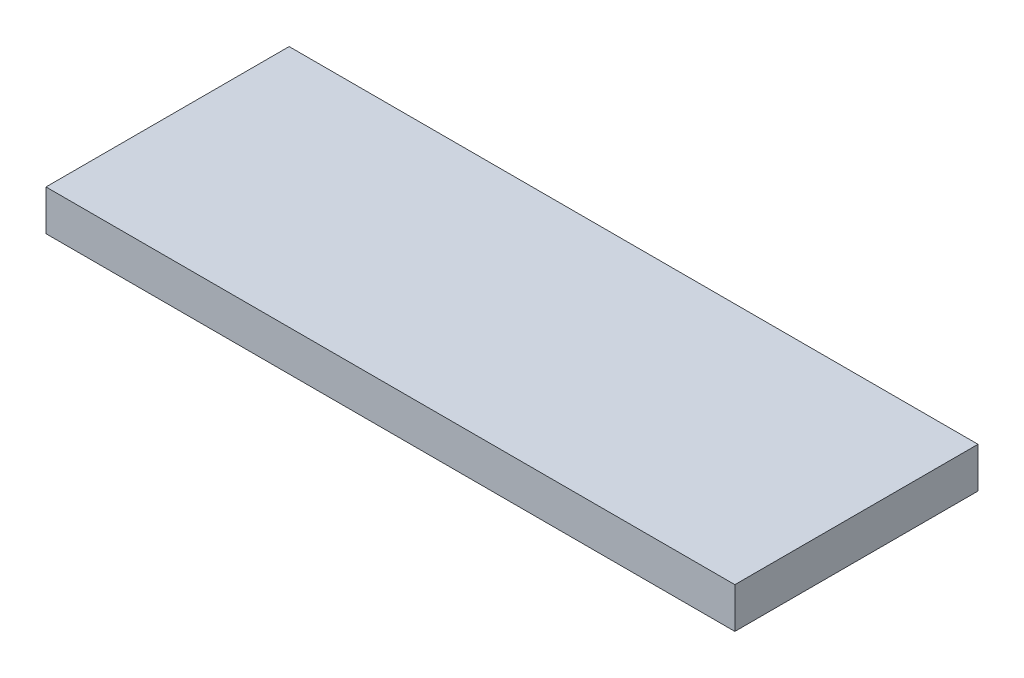
from build123d import *

# Parameters (mm, degrees)
SKETCH1_W           = 85
SKETCH1_H           = 30
BOSS_EXTRUDE1_DEPTH = 5


with BuildPart() as part:
    # Sketch1 → Boss-Extrude1 (new body)
    with BuildSketch(Plane(origin=(0, 0, 0), x_dir=(1, 0, 0), z_dir=(0, 1, 0))):
        with Locations((42.5, 15)):
            Rectangle(SKETCH1_W, SKETCH1_H)
    extrude(amount=BOSS_EXTRUDE1_DEPTH)


solid = part.part
